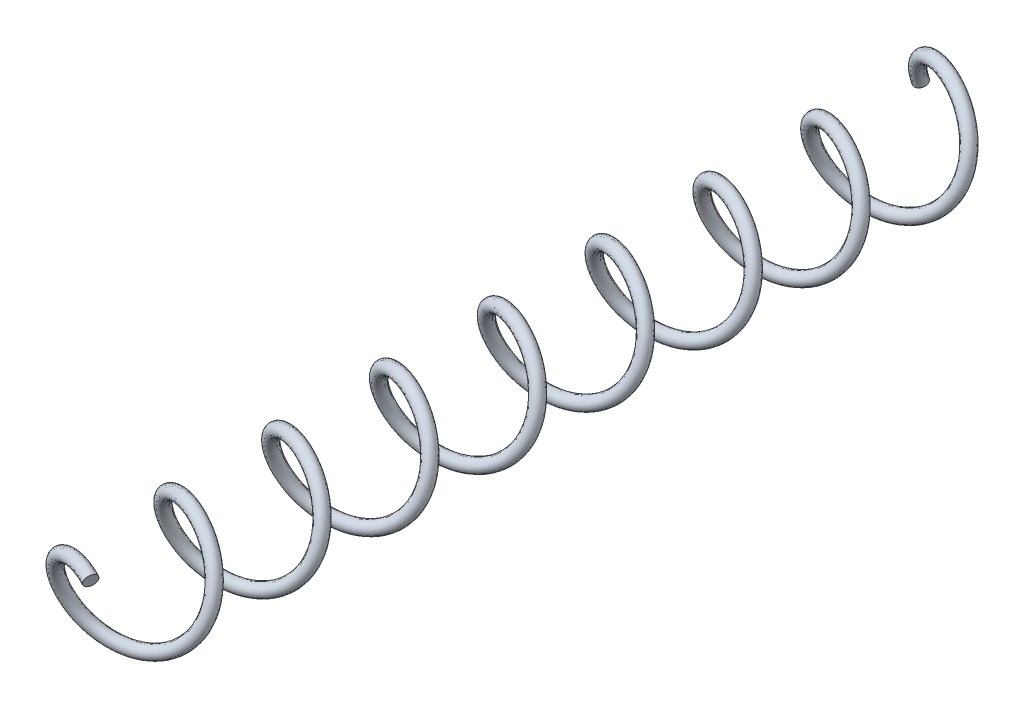
from build123d import *

# Parameters (mm, degrees)
SWEEP1_PITCH       = 3.175
SWEEP1_HEIGHT      = 26.3525
SWEEP1_RADIUS      = 1.4605
SWEEP1_START_ANGLE = -180
SWEEP1_PROFILE_R   = 0.1905


with BuildPart() as part:
    # Sweep1: sweep along a helix
    with BuildLine() as sweep1_path:
        add(Helix(SWEEP1_PITCH, SWEEP1_HEIGHT, SWEEP1_RADIUS, center=(0, 0, 0), direction=(0, 0, 1), lefthand=True, mode=Mode.PRIVATE).rotate(Axis((0, 0, 0), (0, 0, 1)), SWEEP1_START_ANGLE))
    # Sweep1 profile (on start of the path) → Sweep1 (sweep)
    with BuildSketch(Plane(origin=(-1.4605, 0, 0), x_dir=(0, -0.3269714499835476, 0.9450342167856445), z_dir=(-2.4180172117257505e-13, 0.9450342167856445, 0.3269714499835476))):
        Circle(SWEEP1_PROFILE_R)
    sweep(path=sweep1_path.line, is_frenet=True)


solid = part.part
